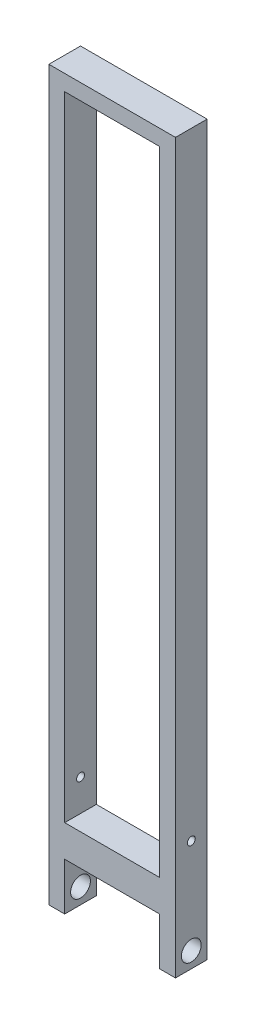
from build123d import *

# Parameters (mm, degrees)
SKETCH1_W           = 152.4
SKETCH1_H           = 1016
BOSS_EXTRUDE1_DEPTH = 50.8
SKETCH2_R           = 15.875
SKETCH2_R_2         = 6.35
CUT_EXTRUDE1_DEPTH  = 1088.167475599


with BuildPart() as part:
    # Sketch1 → Boss-Extrude1 (new body)
    with BuildSketch(Plane.XY):
        Polygon((-76.2, -25.4), (76.2, -25.4), (76.2, -101.6), (101.6, -101.6), (101.6, 1066.8), (-101.6, 1066.8), (-101.6, -101.6), (-76.2, -101.6), align=None)
        with Locations((0, 533.4)):
            Rectangle(SKETCH1_W, SKETCH1_H, mode=Mode.SUBTRACT)
    extrude(amount=BOSS_EXTRUDE1_DEPTH)

    # Sketch2 → Cut-Extrude1 (cut, through all)
    with BuildSketch(Plane(origin=(101.6, 0, 0), x_dir=(0, 0, -1), z_dir=(1, 0, 0))):
        with Locations((-25.4, -76.2)):
            Circle(SKETCH2_R)
        with Locations((-25.4, 76.2)):
            Circle(SKETCH2_R_2)
    extrude(amount=-CUT_EXTRUDE1_DEPTH, mode=Mode.SUBTRACT)


solid = part.part
